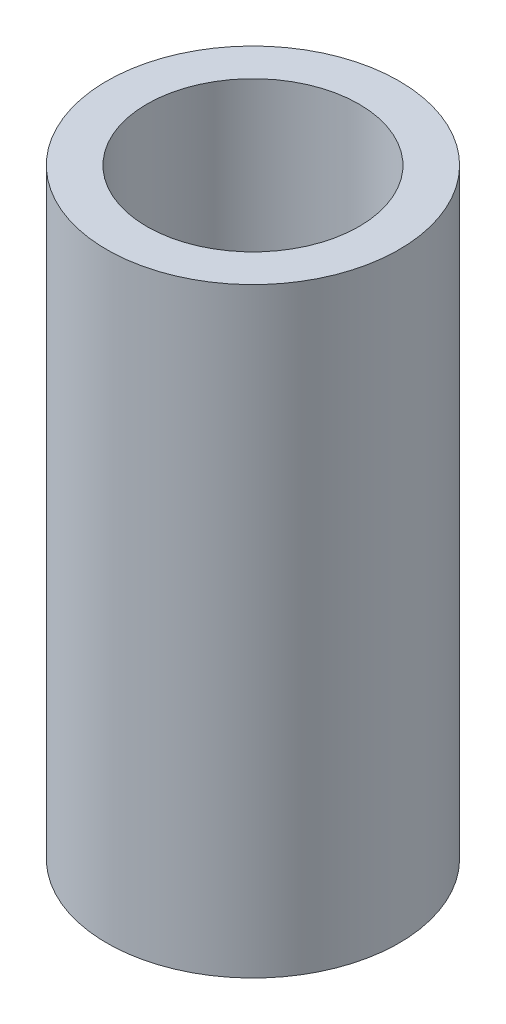
from build123d import *


with BuildPart() as part:
    # Sketch1 → Revolve1 (revolve)
    with BuildSketch(Plane.XY, mode=Mode.PRIVATE) as revolve1_sk:
        Polygon((13.462, 0), (18.542, 0), (18.542, -76.2), (0, -76.2), (0, -44.45), (13.462, -44.45), align=None)
    revolve(revolve1_sk.sketch.rotate(Axis((0, -76.2, 0), (0, 1, 0)), 90), axis=Axis((0, -76.2, 0), (0, 1, 0)))


solid = part.part
